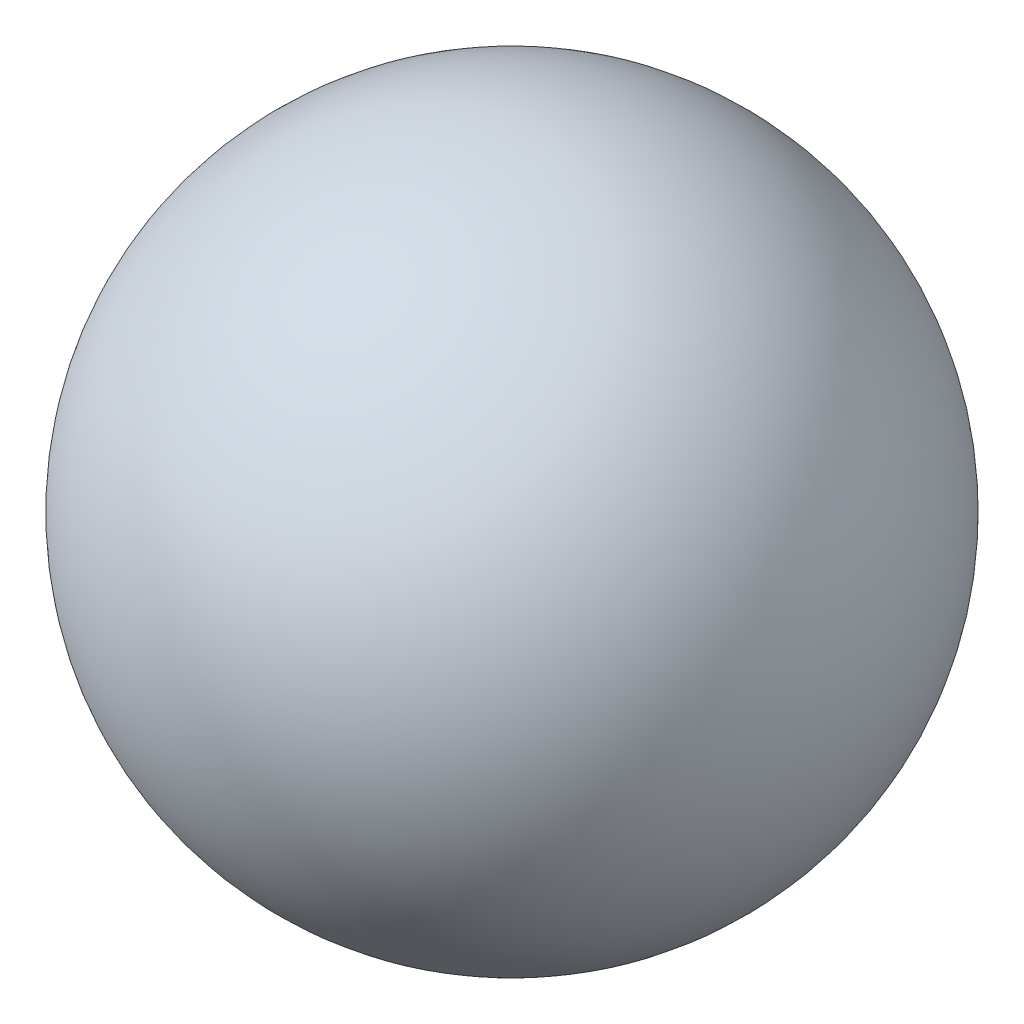
from build123d import *


with BuildPart() as part:
    # Sketch1 → Revolve1 (revolve)
    with BuildSketch(Plane.XY):
        with BuildLine():
            Line((0, 2.78), (0, -2.78))
            ThreePointArc((0, -2.78), (2.78, 0), (0, 2.78))
        make_face()
    revolve(axis=Axis((0, 47.34487267, 0), (0, 1, 0)))


solid = part.part
